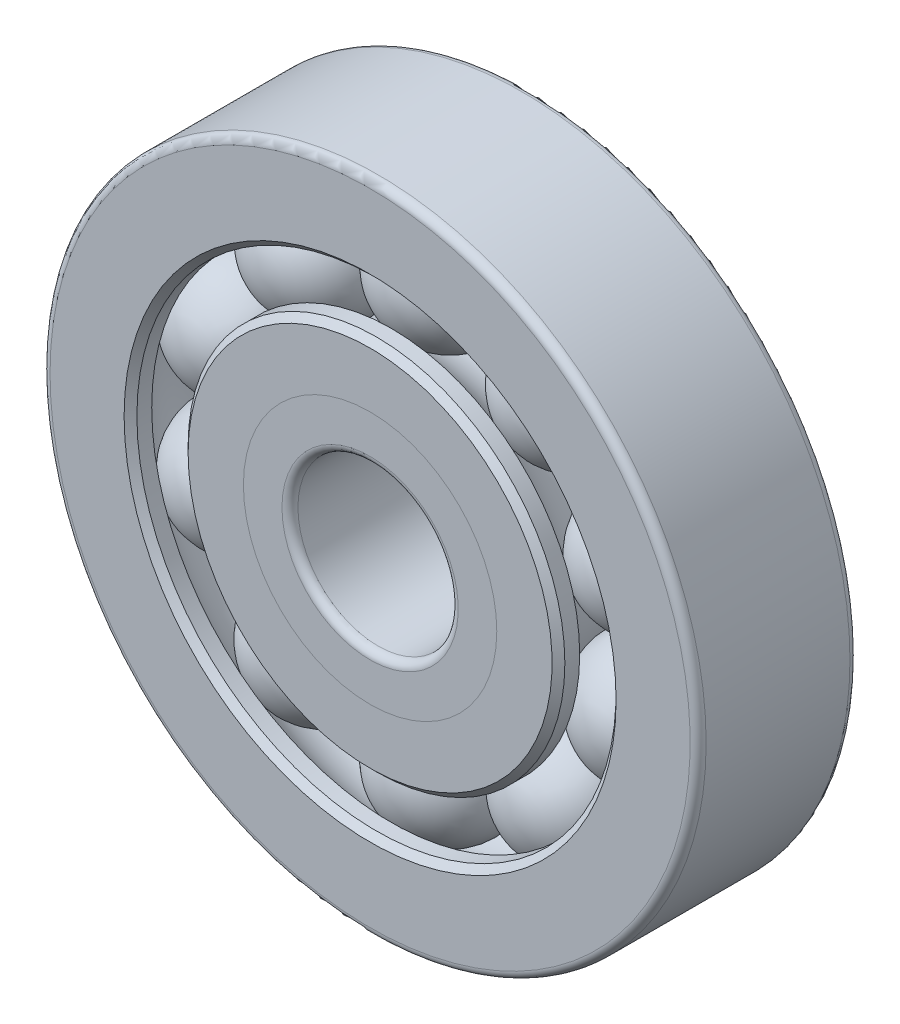
from build123d import *

# Parameters (mm, degrees)
SKETCH3_W              = 7.9248
SKETCH3_H              = 5.36702
SKETCH3_H_2            = 4.38658
SKETCH4_R              = 3.175
CIRPATTERN1_COUNT      = 10
FILLET1_R              = 0.39624
FILLET2_R              = 0.39624
CHAMFER1_SIZE          = 0.316992
CHAMFER2_SIZE          = 0.316992
SPLIT1_SURFACE_1_BACK  = 47.692
SPLIT1_SURFACE_1_DEPTH = 95.384
SPLIT1_SURFACE_2_BACK  = 47.692
SPLIT1_SURFACE_2_DEPTH = 95.384


with BuildPart() as part:
    # Sketch3 → Revolve2 (revolve)
    with BuildSketch(Plane(origin=(0, 0, 0), x_dir=(0, 0, -1), z_dir=(1, 0, 0)), mode=Mode.PRIVATE) as revolve2_sk:
        with Locations((0, 6.65861)):
            Rectangle(SKETCH3_W, SKETCH3_H)
        with Locations((0, 14.07541)):
            Rectangle(SKETCH3_W, SKETCH3_H_2)
    revolve(revolve2_sk.sketch.rotate(Axis((0, 0, 3.9624), (0, 0, -1)), 90), axis=Axis((0, 0, 3.9624), (0, 0, -1)))

    # Sketch4 → Cut-Revolve1 (revolve, cut)
    with BuildSketch(Plane(origin=(0, 0, 0), x_dir=(0, 0, -1), z_dir=(1, 0, 0)), mode=Mode.PRIVATE) as cut_revolve1_sk:
        with Locations((0, 10.61212)):
            Circle(SKETCH4_R)
    revolve(cut_revolve1_sk.sketch.rotate(Axis((0, 0, 3.9624), (0, 0, -1)), 90), axis=Axis((0, 0, 3.9624), (0, 0, -1)), mode=Mode.SUBTRACT)

    # Fillet1
    fillet1_edges = [part.edges().sort_by_distance(p)[0] for p in [
        (-16.2687, 0, -3.9624),
        (-16.2687, 0, 3.9624),
    ]]
    fillet(fillet1_edges, radius=FILLET1_R)

    # Fillet2
    fillet2_edges = [part.edges().sort_by_distance(p)[0] for p in [
        (-3.9751, 0, 3.9624),
        (-3.9751, 0, -3.9624),
    ]]
    fillet(fillet2_edges, radius=FILLET2_R)

    # Chamfer1
    chamfer1_edges = [part.edges().sort_by_distance(p)[0] for p in [
        (-11.88212, 0, -3.9624),
        (-11.88212, 0, 3.9624),
    ]]
    chamfer(chamfer1_edges, length=CHAMFER1_SIZE)

    # Chamfer2
    chamfer2_edges = [part.edges().sort_by_distance(p)[0] for p in [
        (-9.34212, 0, 3.9624),
        (-9.34212, 0, -3.9624),
    ]]
    chamfer(chamfer2_edges, length=CHAMFER2_SIZE)


with BuildPart() as body_2:
    # Sketch5 → Revolve3 (revolve)
    with BuildSketch(Plane(origin=(0, 0, 0), x_dir=(0, 0, -1), z_dir=(1, 0, 0))):
        with BuildLine():
            Line((-3.175, 10.61212), (3.175, 10.61212))
            ThreePointArc((3.175, 10.61212), (0, 13.78712), (-3.175, 10.61212))
        make_face()
    revolve(axis=Axis((0, 10.61212, 3.175), (0, 0, -1)))


with BuildPart() as cirpattern1_1:
    # CirPattern1: pattern copy
    add(body_2.part.rotate(Axis((0, 0, 0), (0, 0, 1)), 1 * 360 / CIRPATTERN1_COUNT))


with BuildPart() as cirpattern1_2:
    # CirPattern1: pattern copy
    add(body_2.part.rotate(Axis((0, 0, 0), (0, 0, 1)), 2 * 360 / CIRPATTERN1_COUNT))


with BuildPart() as cirpattern1_3:
    # CirPattern1: pattern copy
    add(body_2.part.rotate(Axis((0, 0, 0), (0, 0, 1)), 3 * 360 / CIRPATTERN1_COUNT))


with BuildPart() as cirpattern1_4:
    # CirPattern1: pattern copy
    add(body_2.part.rotate(Axis((0, 0, 0), (0, 0, 1)), 4 * 360 / CIRPATTERN1_COUNT))


with BuildPart() as cirpattern1_5:
    # CirPattern1: pattern copy
    add(body_2.part.rotate(Axis((0, 0, 0), (0, 0, 1)), 5 * 360 / CIRPATTERN1_COUNT))


with BuildPart() as cirpattern1_6:
    # CirPattern1: pattern copy
    add(body_2.part.rotate(Axis((0, 0, 0), (0, 0, 1)), 6 * 360 / CIRPATTERN1_COUNT))


with BuildPart() as cirpattern1_7:
    # CirPattern1: pattern copy
    add(body_2.part.rotate(Axis((0, 0, 0), (0, 0, 1)), 7 * 360 / CIRPATTERN1_COUNT))


with BuildPart() as cirpattern1_8:
    # CirPattern1: pattern copy
    add(body_2.part.rotate(Axis((0, 0, 0), (0, 0, 1)), 8 * 360 / CIRPATTERN1_COUNT))


with BuildPart() as cirpattern1_9:
    # CirPattern1: pattern copy
    add(body_2.part.rotate(Axis((0, 0, 0), (0, 0, 1)), 9 * 360 / CIRPATTERN1_COUNT))


with BuildPart() as body_12:
    # Split1: the piece behind the surface
    add(part.part)
    # Split1 surface: a surface, the sketch's curves swept straight by 95.384 mm
    with BuildLine(Plane.XY.offset(-SPLIT1_SURFACE_1_BACK), mode=Mode.PRIVATE) as split1_surface_1_path:
        CenterArc((0, 0), 6.283113333, 0, 360)
    split1_surface_1 = Shell.extrude(split1_surface_1_path.wire(), (0 * SPLIT1_SURFACE_1_DEPTH, 0 * SPLIT1_SURFACE_1_DEPTH, 1 * SPLIT1_SURFACE_1_DEPTH))
    split(bisect_by=split1_surface_1, keep=Keep.BOTTOM)


with BuildPart() as part_1:
    add(part.part)

    # Split1: split by a surface, the side it looks to stays
    # Split1 surface: a surface, the sketch's curves swept straight by 95.384 mm
    with BuildLine(Plane.XY.offset(-SPLIT1_SURFACE_2_BACK), mode=Mode.PRIVATE) as split1_surface_2_path:
        CenterArc((0, 0), 6.283113333, 0, 360)
    split1_surface_2 = Shell.extrude(split1_surface_2_path.wire(), (0 * SPLIT1_SURFACE_2_DEPTH, 0 * SPLIT1_SURFACE_2_DEPTH, 1 * SPLIT1_SURFACE_2_DEPTH))
    split(bisect_by=split1_surface_2, keep=Keep.TOP)


solid = Compound([body_2.part, cirpattern1_1.part, cirpattern1_2.part, cirpattern1_3.part, cirpattern1_4.part, cirpattern1_5.part, cirpattern1_6.part, cirpattern1_7.part, cirpattern1_8.part, cirpattern1_9.part, body_12.part, part_1.part])
